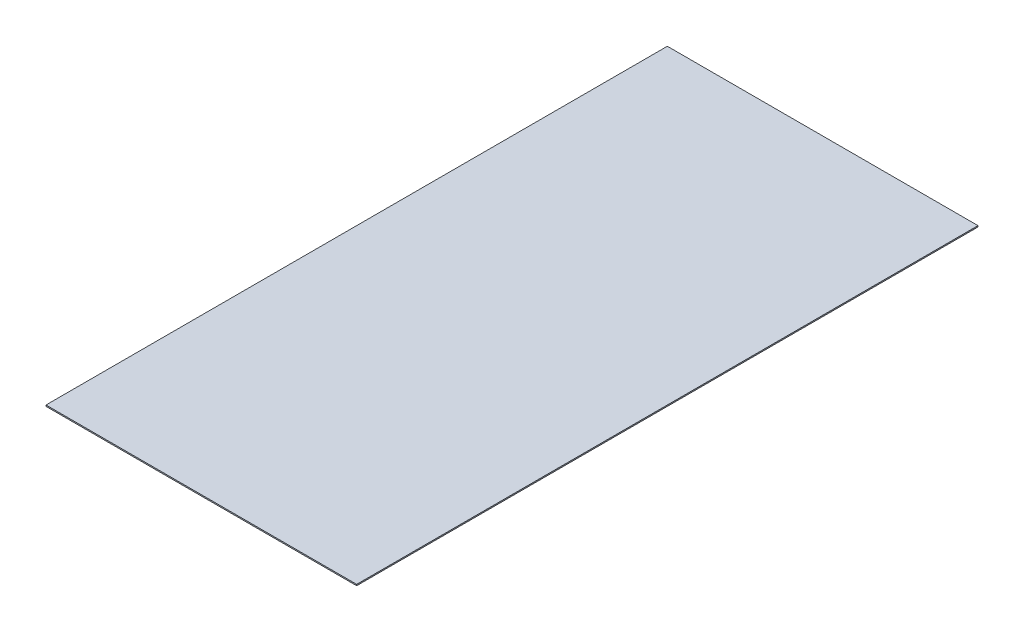
from build123d import *

# Parameters (mm, degrees)
CROQUIS1_W              = 1219.2
CROQUIS1_H              = 2438.4
SALIENTE_EXTRUIR1_DEPTH = 4.8


with BuildPart() as part:
    # Croquis1 → Saliente-Extruir1 (new body)
    with BuildSketch(Plane(origin=(0, 0, 0), x_dir=(1, 0, 0), z_dir=(0, 1, 0))):
        Rectangle(CROQUIS1_W, CROQUIS1_H)
    extrude(amount=SALIENTE_EXTRUIR1_DEPTH)


solid = part.part
